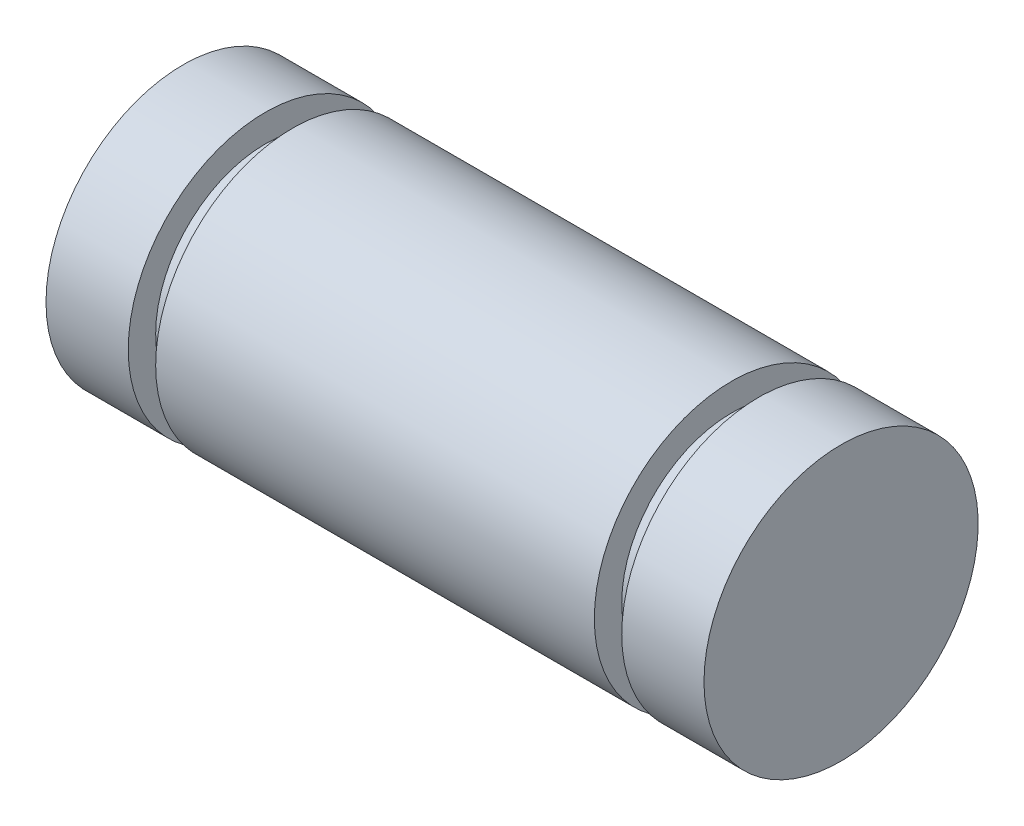
from build123d import *


with BuildPart() as part:
    # Sketch1 → Revolve1 (revolve)
    with BuildSketch(Plane.XY, mode=Mode.PRIVATE) as revolve1_sk:
        Polygon((0, 0), (12, 0), (12, 2.5), (10.5, 2.5), (10.5, 2), (10, 2), (10, 2.5), (2, 2.5), (2, 2), (1.5, 2), (1.5, 2.5), (0, 2.5), align=None)
    revolve(revolve1_sk.sketch.rotate(Axis((0, 0, 0), (1, 0, 0)), 90), axis=Axis((0, 0, 0), (1, 0, 0)))


solid = part.part
